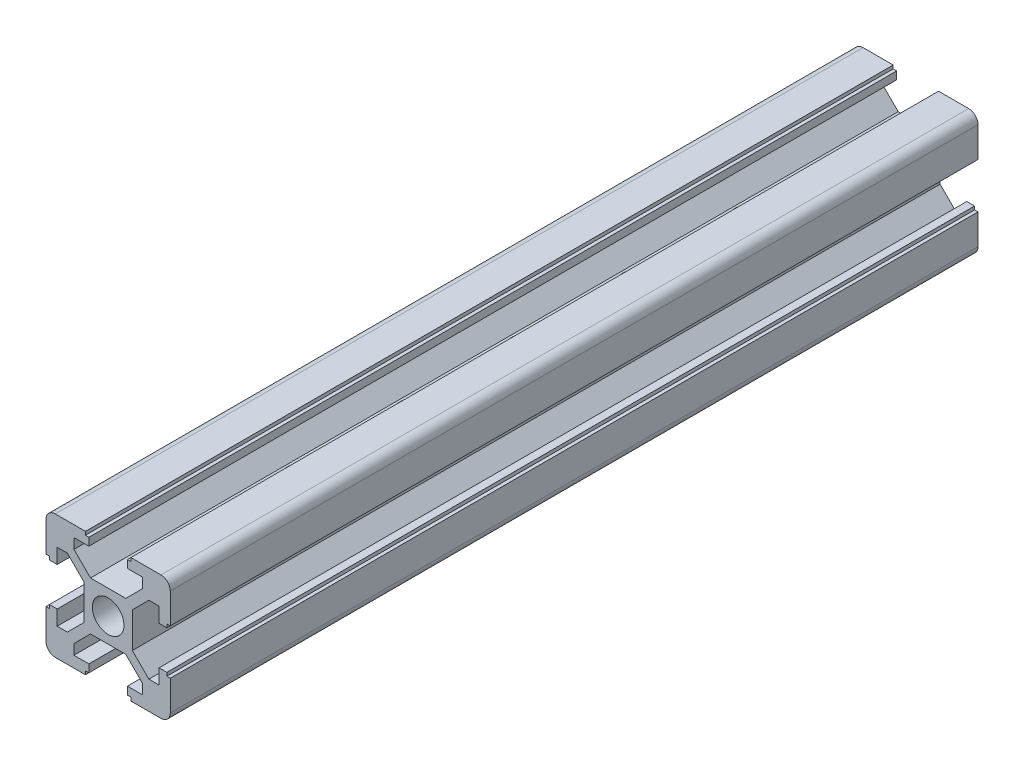
from build123d import *

# Parameters (mm, degrees)
SKETCH_1_R          = 2.55
EXTRUDE_1_DEPTH     = 130
SKETCH_2_R          = 2.5
CUT_EXTRUDE_1_DEPTH = 20


with BuildPart() as part:
    # 草图1 → 凸台-拉伸1 (new body)
    with BuildSketch(Plane.XY):
        with BuildLine():
            Line((-3.9, 2.839339828), (-6.560660172, 5.5))
            Line((-6.560660172, 5.5), (-8.2, 5.5))
            Line((-8.2, 5.5), (-8.2, 3.1))
            Line((-8.2, 3.1), (-9.45, 3.1))
            Line((-9.45, 3.1), (-9.45, 3.65))
            Line((-9.45, 3.65), (-10, 3.65))
            Line((-10, 3.65), (-10, 8.5))
            ThreePointArc((-10, 8.5), (-9.560660172, 9.560660172), (-8.5, 10))
            Line((-8.5, 10), (-3.65, 10))
            Line((-3.65, 10), (-3.65, 9.45))
            Line((-3.65, 9.45), (-3.1, 9.45))
            Line((-3.1, 9.45), (-3.1, 8.2))
            Line((-3.1, 8.2), (-5.5, 8.2))
            Line((-5.5, 8.2), (-5.5, 6.560660172))
            Line((-5.5, 6.560660172), (-2.839339828, 3.9))
            Line((-2.839339828, 3.9), (2.839339828, 3.9))
            Line((2.839339828, 3.9), (5.5, 6.560660172))
            Line((5.5, 6.560660172), (5.5, 8.2))
            Line((5.5, 8.2), (3.1, 8.2))
            Line((3.1, 8.2), (3.1, 9.45))
            Line((3.1, 9.45), (3.65, 9.45))
            Line((3.65, 9.45), (3.65, 10))
            Line((3.65, 10), (8.5, 10))
            ThreePointArc((8.5, 10), (9.560660172, 9.560660172), (10, 8.5))
            Line((10, 8.5), (10, 3.65))
            Line((10, 3.65), (9.45, 3.65))
            Line((9.45, 3.65), (9.45, 3.1))
            Line((9.45, 3.1), (8.2, 3.1))
            Line((8.2, 3.1), (8.2, 5.5))
            Line((8.2, 5.5), (6.560660172, 5.5))
            Line((6.560660172, 5.5), (3.9, 2.839339828))
            Line((3.9, 2.839339828), (3.9, -2.839339828))
            Line((3.9, -2.839339828), (6.560660172, -5.5))
            Line((6.560660172, -5.5), (8.2, -5.5))
            Line((8.2, -5.5), (8.2, -3.1))
            Line((8.2, -3.1), (9.45, -3.1))
            Line((9.45, -3.1), (9.45, -3.65))
            Line((9.45, -3.65), (10, -3.65))
            Line((10, -3.65), (10, -8.5))
            ThreePointArc((10, -8.5), (9.560660172, -9.560660172), (8.5, -10))
            Line((8.5, -10), (3.65, -10))
            Line((3.65, -10), (3.65, -9.45))
            Line((3.65, -9.45), (3.1, -9.45))
            Line((3.1, -9.45), (3.1, -8.2))
            Line((3.1, -8.2), (5.5, -8.2))
            Line((5.5, -8.2), (5.5, -6.560660172))
            Line((5.5, -6.560660172), (2.839339828, -3.9))
            Line((2.839339828, -3.9), (-2.839339828, -3.9))
            Line((-2.839339828, -3.9), (-5.5, -6.560660172))
            Line((-5.5, -6.560660172), (-5.5, -8.2))
            Line((-5.5, -8.2), (-3.1, -8.2))
            Line((-3.1, -8.2), (-3.1, -9.45))
            Line((-3.1, -9.45), (-3.65, -9.45))
            Line((-3.65, -9.45), (-3.65, -10))
            Line((-3.65, -10), (-8.5, -10))
            ThreePointArc((-8.5, -10), (-9.560660172, -9.560660172), (-10, -8.5))
            Line((-10, -8.5), (-10, -3.65))
            Line((-10, -3.65), (-9.45, -3.65))
            Line((-9.45, -3.65), (-9.45, -3.1))
            Line((-9.45, -3.1), (-8.2, -3.1))
            Line((-8.2, -3.1), (-8.2, -5.5))
            Line((-8.2, -5.5), (-6.560660172, -5.5))
            Line((-6.560660172, -5.5), (-3.9, -2.839339828))
            Line((-3.9, -2.839339828), (-3.9, 2.839339828))
        make_face()
        Circle(SKETCH_1_R, mode=Mode.SUBTRACT)
    extrude(amount=EXTRUDE_1_DEPTH)

    # 草图2 → 切除-拉伸1 (cut)
    with BuildSketch(Plane.XZ.offset(3.9)):
        with Locations(Location((0, 98.618711662, 0), (0, 0, 270))):
            Circle(SKETCH_2_R)
        with Locations(Location((0, 80.618711662, 0), (0, 0, 270))):
            Circle(SKETCH_2_R)
        with Locations(Location((0, 62.618711662, 0), (0, 0, 270))):
            Circle(SKETCH_2_R)
        with Locations(Location((0, 44.618711662, 0), (0, 0, 270))):
            Circle(SKETCH_2_R)
        with Locations(Location((0, 26.618711662, 0), (0, 0, 270))):
            Circle(SKETCH_2_R)
    extrude(amount=-CUT_EXTRUDE_1_DEPTH, mode=Mode.SUBTRACT)


solid = part.part
